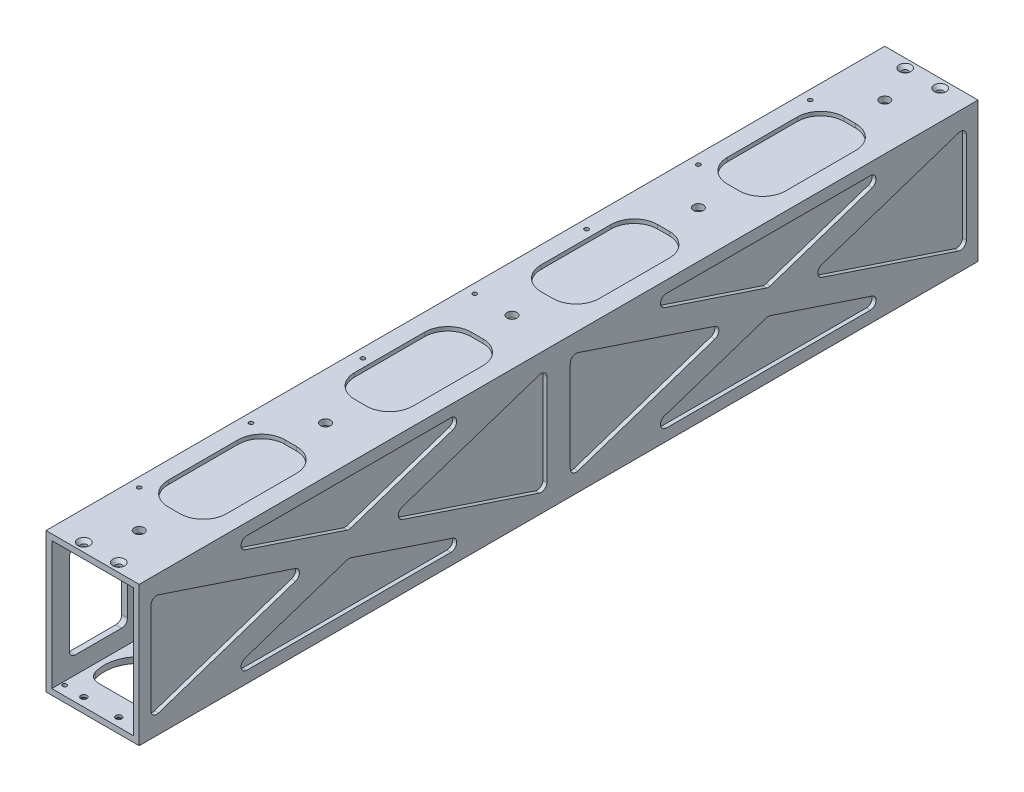
from build123d import *

# Parameters (mm, degrees)
SKETCH1_W                                     = 50.8
SKETCH1_H                                     = 76.2
SKETCH1_W_2                                   = 44.45
SKETCH1_H_2                                   = 69.85
BOSS_EXTRUDE1_DEPTH                           = 457.2
CUT_EXTRUDE2_DEPTH                            = 467.282017667
F_1_4_28_TAPPED_HOLE1_D                       = 5.4102
F_1_4_28_TAPPED_HOLE1_DEPTH                   = 3.175
SKETCH6_W                                     = 53.975
SKETCH6_H                                     = 76.2
BOSS_EXTRUDE2_DEPTH                           = 3.175
CUT_EXTRUDE4_REACH                            = 468.282
SKETCH7_W                                     = 31.75
SKETCH7_H                                     = 50.8
FILLET1_R                                     = 3.175
CUT_EXTRUDE6_REACH                            = 468.282
SKETCH9_R                                     = 19.05
CUT_EXTRUDE7_REACH                            = 468.282
LPATTERN1_COUNT                               = 4
LPATTERN1_PITCH                               = 101.6
CSK_FOR_4_FLAT_HEAD_SOCKET_CAP_SCREW1_A_COUNT = 2
CSK_FOR_4_FLAT_HEAD_SOCKET_CAP_SCREW1_A_PITCH = 19.05
BOSS_EXTRUDE3_START                           = -1.016
BOSS_EXTRUDE3_DEPTH                           = 1.016
BOSS_EXTRUDE4_START                           = -1.016
SKETCH16_R                                    = 19.05
BOSS_EXTRUDE4_DEPTH                           = 1.016
BOSS_EXTRUDE5_START                           = -1.016
BOSS_EXTRUDE5_DEPTH                           = 1.016
F_4_40_TAPPED_HOLE1_D                         = 2.2606
F_4_40_TAPPED_HOLE1_DEPTH                     = 3.175
BOSS_EXTRUDE6_START                           = 2.159
BOSS_EXTRUDE6_DEPTH                           = 2.159
FILLET2_R                                     = 6.35
CUT_EXTRUDE8_REACH                            = 467.934
F_4_40_TAPPED_HOLE2_D                         = 2.2606
F_4_40_TAPPED_HOLE2_DEPTH                     = 3.175


with BuildPart() as part:
    # Sketch1 → Boss-Extrude1 (new body)
    with BuildSketch(Plane.XY):
        with Locations((25.4, 38.1)):
            Rectangle(SKETCH1_W, SKETCH1_H)
        with Locations((25.4, 38.1)):
            Rectangle(SKETCH1_W_2, SKETCH1_H_2, mode=Mode.SUBTRACT)
    extrude(amount=BOSS_EXTRUDE1_DEPTH)

    # Sketch2 → Cut-Extrude2 (cut, through all)
    with BuildSketch(Plane(origin=(50.8, 0, 0), x_dir=(0, 0, -1), z_dir=(1, 0, 0))):
        with BuildLine():
            Line((-222.25, 62.984768429), (-222.25, 13.215231571))
            ThreePointArc((-222.25, 13.215231571), (-220.931455154, 10.639537633), (-218.070976843, 10.2031621))
            Line((-218.070976843, 10.2031621), (-143.416671556, 35.087930529))
            ThreePointArc((-143.416671556, 35.087930529), (-141.245694713, 38.1), (-143.416671556, 41.112069471))
            Line((-143.416671556, 41.112069471), (-218.070976843, 65.9968379))
            ThreePointArc((-218.070976843, 65.9968379), (-220.931455154, 65.560462367), (-222.25, 62.984768429))
        make_face()
        with BuildLine():
            Line((-399.508328444, 63.662930529), (-343.904023157, 45.1281621))
            ThreePointArc((-343.904023157, 45.1281621), (-342.9, 44.965231571), (-341.895976843, 45.1281621))
            Line((-341.895976843, 45.1281621), (-286.291671556, 63.662930529))
            ThreePointArc((-286.291671556, 63.662930529), (-284.161692035, 67.183578622), (-287.295694713, 69.85))
            Line((-287.295694713, 69.85), (-398.504305287, 69.85))
            ThreePointArc((-398.504305287, 69.85), (-401.638307965, 67.183578622), (-399.508328444, 63.662930529))
        make_face()
        with BuildLine():
            Line((-446.670976843, 65.9968379), (-372.016671556, 41.112069471))
            ThreePointArc((-372.016671556, 41.112069471), (-369.845694713, 38.1), (-372.016671556, 35.087930529))
            Line((-372.016671556, 35.087930529), (-446.670976843, 10.2031621))
            ThreePointArc((-446.670976843, 10.2031621), (-449.531455154, 10.639537633), (-450.85, 13.215231571))
            Line((-450.85, 13.215231571), (-450.85, 62.984768429))
            ThreePointArc((-450.85, 62.984768429), (-449.531455154, 65.560462367), (-446.670976843, 65.9968379))
        make_face()
        with BuildLine():
            Line((-234.95, 62.984768429), (-234.95, 13.215231571))
            ThreePointArc((-234.95, 13.215231571), (-236.268544846, 10.639537633), (-239.129023157, 10.2031621))
            Line((-239.129023157, 10.2031621), (-313.783328444, 35.087930529))
            ThreePointArc((-313.783328444, 35.087930529), (-315.954305287, 38.1), (-313.783328444, 41.112069471))
            Line((-313.783328444, 41.112069471), (-239.129023157, 65.9968379))
            ThreePointArc((-239.129023157, 65.9968379), (-236.268544846, 65.560462367), (-234.95, 62.984768429))
        make_face()
        with BuildLine():
            Line((-57.691671556, 63.662930529), (-113.295976843, 45.1281621))
            ThreePointArc((-113.295976843, 45.1281621), (-114.3, 44.965231571), (-115.304023157, 45.1281621))
            Line((-115.304023157, 45.1281621), (-170.908328444, 63.662930529))
            ThreePointArc((-170.908328444, 63.662930529), (-173.038307965, 67.183578622), (-169.904305287, 69.85))
            Line((-169.904305287, 69.85), (-58.695694713, 69.85))
            ThreePointArc((-58.695694713, 69.85), (-55.561692035, 67.183578622), (-57.691671556, 63.662930529))
        make_face()
        with BuildLine():
            Line((-10.529023157, 65.9968379), (-85.183328444, 41.112069471))
            ThreePointArc((-85.183328444, 41.112069471), (-87.354305287, 38.1), (-85.183328444, 35.087930529))
            Line((-85.183328444, 35.087930529), (-10.529023157, 10.2031621))
            ThreePointArc((-10.529023157, 10.2031621), (-7.668544846, 10.639537633), (-6.35, 13.215231571))
            Line((-6.35, 13.215231571), (-6.35, 62.984768429))
            ThreePointArc((-6.35, 62.984768429), (-7.668544846, 65.560462367), (-10.529023157, 65.9968379))
        make_face()
        with BuildLine():
            Line((-398.504305287, 6.35), (-287.295694713, 6.35))
            ThreePointArc((-287.295694713, 6.35), (-284.161692035, 9.016421378), (-286.291671556, 12.537069471))
            Line((-286.291671556, 12.537069471), (-341.895976843, 31.0718379))
            ThreePointArc((-341.895976843, 31.0718379), (-342.9, 31.234768429), (-343.904023157, 31.0718379))
            Line((-343.904023157, 31.0718379), (-399.508328444, 12.537069471))
            ThreePointArc((-399.508328444, 12.537069471), (-401.638307965, 9.016421378), (-398.504305287, 6.35))
        make_face()
        with BuildLine():
            Line((-113.295976843, 31.0718379), (-57.691671556, 12.537069471))
            ThreePointArc((-57.691671556, 12.537069471), (-55.561692035, 9.016421378), (-58.695694713, 6.35))
            Line((-58.695694713, 6.35), (-169.904305287, 6.35))
            ThreePointArc((-169.904305287, 6.35), (-173.038307965, 9.016421378), (-170.908328444, 12.537069471))
            Line((-170.908328444, 12.537069471), (-115.304023157, 31.0718379))
            ThreePointArc((-115.304023157, 31.0718379), (-114.3, 31.234768429), (-113.295976843, 31.0718379))
        make_face()
    extrude(amount=-CUT_EXTRUDE2_DEPTH, mode=Mode.SUBTRACT)

    # 1/4-28 Tapped Hole1
    with Locations(Plane(origin=(0, 76.2, 0), x_dir=(-1, 0, 0), z_dir=(0, 1, 0))):
        with Locations((-25.4, 25.4), (-25.4, 228.6), (-25.4, 431.8), (-25.4, 330.2), (-25.4, 127)):
            Hole(F_1_4_28_TAPPED_HOLE1_D / 2, depth=F_1_4_28_TAPPED_HOLE1_DEPTH)

    # Sketch6 → Boss-Extrude2 (add)
    with BuildSketch(Plane.ZY):
        with Locations((26.9875, 38.1)):
            Rectangle(SKETCH6_W, SKETCH6_H)
    boss_extrude2 = extrude(amount=-BOSS_EXTRUDE2_DEPTH)

    # Sketch7 → Cut-Extrude4 (cut, up to next)
    with BuildSketch(Plane.ZY, mode=Mode.PRIVATE) as cut_extrude4_sk1:
        with Locations((25.4, 38.1)):
            Rectangle(SKETCH7_W, SKETCH7_H)
    cut_extrude4_tool1 = extrude(cut_extrude4_sk1.sketch, amount=-CUT_EXTRUDE4_REACH, mode=Mode.PRIVATE) & part.part
    cut_extrude4 = cut_extrude4_tool1.solids().sort_by_distance((0, 38.1, 25.4))[0]
    add(cut_extrude4, mode=Mode.SUBTRACT)

    # Mirror1: Boss-Extrude2, Cut-Extrude4 across plane
    add(boss_extrude2.mirror(Plane.XY.offset(228.6)))
    add(cut_extrude4.mirror(Plane.XY.offset(228.6)), mode=Mode.SUBTRACT)

    # Fillet1
    fillet1_edges = [part.edges().sort_by_distance(p)[0] for p in [
        (1.5875, 51.514845619, 53.975),
        (1.5875, 24.685154381, 53.975),
        (1.5875, 63.5, 41.275),
        (1.5875, 12.7, 41.275),
        (1.5875, 12.7, 9.525),
        (1.5875, 63.5, 9.525),
        (1.5875, 24.685154381, 403.225),
        (1.5875, 51.514845619, 403.225),
        (1.5875, 12.7, 415.925),
        (1.5875, 63.5, 415.925),
        (1.5875, 63.5, 447.675),
        (1.5875, 12.7, 447.675),
    ]]
    fillet(fillet1_edges, radius=FILLET1_R)

    # Sketch9 → Cut-Extrude6 (cut, up to next)
    with BuildSketch(Plane.XZ, mode=Mode.PRIVATE) as cut_extrude6_sk1:
        with Locations(Location((25.4, 431.8, 0), (0, 0, 270))):
            Circle(SKETCH9_R)
    cut_extrude6_tool1 = extrude(cut_extrude6_sk1.sketch, amount=-CUT_EXTRUDE6_REACH, mode=Mode.PRIVATE) & part.part
    # Sketch9 → Cut-Extrude6 (cut, up to next)
    with BuildSketch(Plane.XZ, mode=Mode.PRIVATE) as cut_extrude6_sk2:
        with Locations(Location((25.4, 381, 0), (0, 0, 270))):
            Circle(SKETCH9_R)
    cut_extrude6_tool2 = extrude(cut_extrude6_sk2.sketch, amount=-CUT_EXTRUDE6_REACH, mode=Mode.PRIVATE) & part.part
    # Sketch9 → Cut-Extrude6 (cut, up to next)
    with BuildSketch(Plane.XZ, mode=Mode.PRIVATE) as cut_extrude6_sk3:
        with Locations(Location((25.4, 330.2, 0), (0, 0, 270))):
            Circle(SKETCH9_R)
    cut_extrude6_tool3 = extrude(cut_extrude6_sk3.sketch, amount=-CUT_EXTRUDE6_REACH, mode=Mode.PRIVATE) & part.part
    # Sketch9 → Cut-Extrude6 (cut, up to next)
    with BuildSketch(Plane.XZ, mode=Mode.PRIVATE) as cut_extrude6_sk4:
        with Locations(Location((25.4, 279.4, 0), (0, 0, 270))):
            Circle(SKETCH9_R)
    cut_extrude6_tool4 = extrude(cut_extrude6_sk4.sketch, amount=-CUT_EXTRUDE6_REACH, mode=Mode.PRIVATE) & part.part
    # Sketch9 → Cut-Extrude6 (cut, up to next)
    with BuildSketch(Plane.XZ, mode=Mode.PRIVATE) as cut_extrude6_sk5:
        with Locations(Location((25.4, 228.6, 0), (0, 0, 270))):
            Circle(SKETCH9_R)
    cut_extrude6_tool5 = extrude(cut_extrude6_sk5.sketch, amount=-CUT_EXTRUDE6_REACH, mode=Mode.PRIVATE) & part.part
    # Sketch9 → Cut-Extrude6 (cut, up to next)
    with BuildSketch(Plane.XZ, mode=Mode.PRIVATE) as cut_extrude6_sk6:
        with Locations(Location((25.4, 177.8, 0), (0, 0, 270))):
            Circle(SKETCH9_R)
    cut_extrude6_tool6 = extrude(cut_extrude6_sk6.sketch, amount=-CUT_EXTRUDE6_REACH, mode=Mode.PRIVATE) & part.part
    # Sketch9 → Cut-Extrude6 (cut, up to next)
    with BuildSketch(Plane.XZ, mode=Mode.PRIVATE) as cut_extrude6_sk7:
        with Locations(Location((25.4, 127, 0), (0, 0, 270))):
            Circle(SKETCH9_R)
    cut_extrude6_tool7 = extrude(cut_extrude6_sk7.sketch, amount=-CUT_EXTRUDE6_REACH, mode=Mode.PRIVATE) & part.part
    # Sketch9 → Cut-Extrude6 (cut, up to next)
    with BuildSketch(Plane.XZ, mode=Mode.PRIVATE) as cut_extrude6_sk8:
        with Locations(Location((25.4, 76.2, 0), (0, 0, 270))):
            Circle(SKETCH9_R)
    cut_extrude6_tool8 = extrude(cut_extrude6_sk8.sketch, amount=-CUT_EXTRUDE6_REACH, mode=Mode.PRIVATE) & part.part
    # Sketch9 → Cut-Extrude6 (cut, up to next)
    with BuildSketch(Plane.XZ, mode=Mode.PRIVATE) as cut_extrude6_sk9:
        with Locations(Location((25.4, 25.4, 0), (0, 0, 270))):
            Circle(SKETCH9_R)
    cut_extrude6_tool9 = extrude(cut_extrude6_sk9.sketch, amount=-CUT_EXTRUDE6_REACH, mode=Mode.PRIVATE) & part.part
    add(cut_extrude6_tool1.solids().sort_by_distance((25.4, 0, 431.8))[0], mode=Mode.SUBTRACT)
    add(cut_extrude6_tool2.solids().sort_by_distance((25.4, 0, 381))[0], mode=Mode.SUBTRACT)
    add(cut_extrude6_tool3.solids().sort_by_distance((25.4, 0, 330.2))[0], mode=Mode.SUBTRACT)
    add(cut_extrude6_tool4.solids().sort_by_distance((25.4, 0, 279.4))[0], mode=Mode.SUBTRACT)
    add(cut_extrude6_tool5.solids().sort_by_distance((25.4, 0, 228.6))[0], mode=Mode.SUBTRACT)
    add(cut_extrude6_tool6.solids().sort_by_distance((25.4, 0, 177.8))[0], mode=Mode.SUBTRACT)
    add(cut_extrude6_tool7.solids().sort_by_distance((25.4, 0, 127))[0], mode=Mode.SUBTRACT)
    add(cut_extrude6_tool8.solids().sort_by_distance((25.4, 0, 76.2))[0], mode=Mode.SUBTRACT)
    add(cut_extrude6_tool9.solids().sort_by_distance((25.4, 0, 25.4))[0], mode=Mode.SUBTRACT)

    # Sketch10 → Cut-Extrude7 (cut, up to next)
    with BuildSketch(Plane(origin=(0, 76.2, 0), x_dir=(1, 0, 0), z_dir=(0, 1, 0)), mode=Mode.PRIVATE) as cut_extrude7_sk1:
        with BuildLine():
            Line((28.575, -107.95), (22.225, -107.95))
            ThreePointArc((22.225, -107.95), (13.244743879, -104.230256121), (9.525, -95.25))
            Line((9.525, -95.25), (9.525, -57.15))
            ThreePointArc((9.525, -57.15), (13.244743879, -48.169743879), (22.225, -44.45))
            Line((22.225, -44.45), (28.575, -44.45))
            ThreePointArc((28.575, -44.45), (37.555256121, -48.169743879), (41.275, -57.15))
            Line((41.275, -57.15), (41.275, -95.25))
            ThreePointArc((41.275, -95.25), (37.555256121, -104.230256121), (28.575, -107.95))
        make_face()
    cut_extrude7_tool1 = extrude(cut_extrude7_sk1.sketch, amount=-CUT_EXTRUDE7_REACH, mode=Mode.PRIVATE) & part.part
    cut_extrude7 = cut_extrude7_tool1.solids().sort_by_distance((25.4, 76.2, 76.2))[0]
    add(cut_extrude7, mode=Mode.SUBTRACT)

    # LPattern1: Cut-Extrude7 ×4
    with Locations(*[(0, 0, i * LPATTERN1_PITCH) for i in range(1, LPATTERN1_COUNT)]):
        add(cut_extrude7, mode=Mode.SUBTRACT)

    # Sketch12 → CSK for #4 Flat Head Socket Cap Screw1 (revolve, cut)
    with BuildSketch(Plane(origin=(15.875, 76.2, 4.7625), x_dir=(0, 0, 1), z_dir=(1, 0, 0))):
        Polygon((0, 0), (0, 3.176), (1.63195, 3.176), (1.63195, 1.848124365), (3.2385, 0), align=None)
    csk_for_4_flat_head_socket_cap_screw1 = revolve(axis=Axis((15.875, 82.55, 4.7625), (0, -1, 0)), mode=Mode.SUBTRACT)

    # CSK for #4 Flat Head Socket Cap Screw1 a: CSK for #4 Flat Head Socket Cap Screw1 ×2
    with Locations(*[(i * CSK_FOR_4_FLAT_HEAD_SOCKET_CAP_SCREW1_A_PITCH, 0, 0) for i in range(1, CSK_FOR_4_FLAT_HEAD_SOCKET_CAP_SCREW1_A_COUNT)]):
        add(csk_for_4_flat_head_socket_cap_screw1, mode=Mode.SUBTRACT)

    # Mirror2: CSK for #4 Flat Head Socket Cap Screw1 across plane
    add(csk_for_4_flat_head_socket_cap_screw1.mirror(Plane.ZX.offset(38.1)), mode=Mode.SUBTRACT)

    # Mirror2 copy 1 sketch → Mirror2 copy 1 (revolve, cut)
    with BuildSketch(Plane(origin=(34.925, 0, 4.7625), x_dir=(0, 0, 1), z_dir=(1, 0, 0))):
        Polygon((0, 0), (0, -3.176), (1.63195, -3.176), (1.63195, -1.848124365), (3.2385, 0), align=None)
    revolve(axis=Axis((34.925, -6.35, 4.7625), (0, -1, 0)), mode=Mode.SUBTRACT)

    # Mirror3: CSK for #4 Flat Head Socket Cap Screw1 across plane
    add(csk_for_4_flat_head_socket_cap_screw1.mirror(Plane(origin=(0, 0, 228.6), x_dir=(1, 0, 0), z_dir=(0, 0, -1))), mode=Mode.SUBTRACT)

    # Mirror3 copy 1 sketch → Mirror3 copy 1 (revolve, cut)
    with BuildSketch(Plane(origin=(34.925, 76.2, 452.4375), x_dir=(0, 0, -1), z_dir=(1, 0, 0))):
        Polygon((0, 0), (0, -3.176), (1.63195, -3.176), (1.63195, -1.848124365), (3.2385, 0), align=None)
    revolve(axis=Axis((34.925, 82.55, 452.4375), (0, 1, 0)), mode=Mode.SUBTRACT)

    # Mirror3 copy 2 sketch → Mirror3 copy 2 (revolve, cut)
    with BuildSketch(Plane(origin=(15.875, 0, 452.4375), x_dir=(0, 0, -1), z_dir=(1, 0, 0))):
        Polygon((0, 0), (0, 3.176), (1.63195, 3.176), (1.63195, 1.848124365), (3.2385, 0), align=None)
    revolve(axis=Axis((15.875, -6.35, 452.4375), (0, 1, 0)), mode=Mode.SUBTRACT)

    # Mirror3 copy 3 sketch → Mirror3 copy 3 (revolve, cut)
    with BuildSketch(Plane(origin=(34.925, 0, 452.4375), x_dir=(0, 0, -1), z_dir=(1, 0, 0))):
        Polygon((0, 0), (0, 3.176), (1.63195, 3.176), (1.63195, 1.848124365), (3.2385, 0), align=None)
    revolve(axis=Axis((34.925, -6.35, 452.4375), (0, 1, 0)), mode=Mode.SUBTRACT)

    # Sketch15 → Boss-Extrude3 (add)
    with BuildSketch(Plane.ZY.offset(-47.625).offset(BOSS_EXTRUDE3_START)):
        with BuildLine():
            Line((446.670976843, 65.9968379), (372.016671556, 41.112069471))
            ThreePointArc((372.016671556, 41.112069471), (369.845694713, 38.1), (372.016671556, 35.087930529))
            Line((372.016671556, 35.087930529), (446.670976843, 10.2031621))
            ThreePointArc((446.670976843, 10.2031621), (449.531455154, 10.639537633), (450.85, 13.215231571))
            Line((450.85, 13.215231571), (450.85, 62.984768429))
            ThreePointArc((450.85, 62.984768429), (449.531455154, 65.560462367), (446.670976843, 65.9968379))
        make_face()
        with BuildLine():
            Line((398.504305287, 69.85), (287.295694713, 69.85))
            ThreePointArc((287.295694713, 69.85), (284.161692035, 67.183578622), (286.291671556, 63.662930529))
            Line((286.291671556, 63.662930529), (341.895976843, 45.1281621))
            ThreePointArc((341.895976843, 45.1281621), (342.9, 44.965231571), (343.904023157, 45.1281621))
            Line((343.904023157, 45.1281621), (399.508328444, 63.662930529))
            ThreePointArc((399.508328444, 63.662930529), (401.638307965, 67.183578622), (398.504305287, 69.85))
        make_face()
        with BuildLine():
            Line((341.895976843, 31.0718379), (286.291671556, 12.537069471))
            ThreePointArc((286.291671556, 12.537069471), (284.161692035, 9.016421378), (287.295694713, 6.35))
            Line((287.295694713, 6.35), (398.504305287, 6.35))
            ThreePointArc((398.504305287, 6.35), (401.638307965, 9.016421378), (399.508328444, 12.537069471))
            Line((399.508328444, 12.537069471), (343.904023157, 31.0718379))
            ThreePointArc((343.904023157, 31.0718379), (342.9, 31.234768429), (341.895976843, 31.0718379))
        make_face()
        with BuildLine():
            Line((239.129023157, 10.2031621), (313.783328444, 35.087930529))
            ThreePointArc((313.783328444, 35.087930529), (315.954305287, 38.1), (313.783328444, 41.112069471))
            Line((313.783328444, 41.112069471), (239.129023157, 65.9968379))
            ThreePointArc((239.129023157, 65.9968379), (236.268544846, 65.560462367), (234.95, 62.984768429))
            Line((234.95, 62.984768429), (234.95, 13.215231571))
            ThreePointArc((234.95, 13.215231571), (236.268544846, 10.639537633), (239.129023157, 10.2031621))
        make_face()
        with BuildLine():
            Line((143.416671556, 35.087930529), (218.070976843, 10.2031621))
            ThreePointArc((218.070976843, 10.2031621), (220.931455154, 10.639537633), (222.25, 13.215231571))
            Line((222.25, 13.215231571), (222.25, 62.984768429))
            ThreePointArc((222.25, 62.984768429), (220.931455154, 65.560462367), (218.070976843, 65.9968379))
            Line((218.070976843, 65.9968379), (143.416671556, 41.112069471))
            ThreePointArc((143.416671556, 41.112069471), (141.245694713, 38.1), (143.416671556, 35.087930529))
        make_face()
        with BuildLine():
            Line((57.691671556, 63.662930529), (113.295976843, 45.1281621))
            ThreePointArc((113.295976843, 45.1281621), (114.3, 44.965231571), (115.304023157, 45.1281621))
            Line((115.304023157, 45.1281621), (170.908328444, 63.662930529))
            ThreePointArc((170.908328444, 63.662930529), (173.038307965, 67.183578622), (169.904305287, 69.85))
            Line((169.904305287, 69.85), (58.695694713, 69.85))
            ThreePointArc((58.695694713, 69.85), (55.561692035, 67.183578622), (57.691671556, 63.662930529))
        make_face()
        with BuildLine():
            Line((113.295976843, 31.0718379), (57.691671556, 12.537069471))
            ThreePointArc((57.691671556, 12.537069471), (55.561692035, 9.016421378), (58.695694713, 6.35))
            Line((58.695694713, 6.35), (169.904305287, 6.35))
            ThreePointArc((169.904305287, 6.35), (173.038307965, 9.016421378), (170.908328444, 12.537069471))
            Line((170.908328444, 12.537069471), (115.304023157, 31.0718379))
            ThreePointArc((115.304023157, 31.0718379), (114.3, 31.234768429), (113.295976843, 31.0718379))
        make_face()
        with BuildLine():
            Line((10.529023157, 10.2031621), (85.183328444, 35.087930529))
            ThreePointArc((85.183328444, 35.087930529), (87.354305287, 38.1), (85.183328444, 41.112069471))
            Line((85.183328444, 41.112069471), (10.529023157, 65.9968379))
            ThreePointArc((10.529023157, 65.9968379), (7.668544846, 65.560462367), (6.35, 62.984768429))
            Line((6.35, 62.984768429), (6.35, 13.215231571))
            ThreePointArc((6.35, 13.215231571), (7.668544846, 10.639537633), (10.529023157, 10.2031621))
        make_face()
    extrude(amount=BOSS_EXTRUDE3_DEPTH)

    # Sketch16 → Boss-Extrude4 (add)
    with BuildSketch(Plane(origin=(0, 3.175, 0), x_dir=(1, 0, 0), z_dir=(0, 1, 0)).offset(BOSS_EXTRUDE4_START)):
        with Locations(Location((25.4, -431.8, 0), (0, 0, 90))):
            Circle(SKETCH16_R)
        with Locations(Location((25.4, -25.4, 0), (0, 0, 90))):
            Circle(SKETCH16_R)
    extrude(amount=BOSS_EXTRUDE4_DEPTH)

    # Sketch17 → Boss-Extrude5 (add)
    with BuildSketch(Plane.XZ.offset(-73.025).offset(BOSS_EXTRUDE5_START)):
        with BuildLine():
            Line((41.275, 57.15), (41.275, 95.25))
            ThreePointArc((41.275, 95.25), (37.555256121, 104.230256121), (28.575, 107.95))
            Line((28.575, 107.95), (22.225, 107.95))
            ThreePointArc((22.225, 107.95), (13.244743879, 104.230256121), (9.525, 95.25))
            Line((9.525, 95.25), (9.525, 57.15))
            ThreePointArc((9.525, 57.15), (13.244743879, 48.169743879), (22.225, 44.45))
            Line((22.225, 44.45), (28.575, 44.45))
            ThreePointArc((28.575, 44.45), (37.555256121, 48.169743879), (41.275, 57.15))
        make_face()
        with BuildLine():
            Line((41.275, 158.75), (41.275, 196.85))
            ThreePointArc((41.275, 196.85), (37.555256121, 205.830256121), (28.575, 209.55))
            Line((28.575, 209.55), (22.225, 209.55))
            ThreePointArc((22.225, 209.55), (13.244743879, 205.830256121), (9.525, 196.85))
            Line((9.525, 196.85), (9.525, 158.75))
            ThreePointArc((9.525, 158.75), (13.244743879, 149.769743879), (22.225, 146.05))
            Line((22.225, 146.05), (28.575, 146.05))
            ThreePointArc((28.575, 146.05), (37.555256121, 149.769743879), (41.275, 158.75))
        make_face()
        with BuildLine():
            Line((41.275, 260.35), (41.275, 298.45))
            ThreePointArc((41.275, 298.45), (37.555256121, 307.430256121), (28.575, 311.15))
            Line((28.575, 311.15), (22.225, 311.15))
            ThreePointArc((22.225, 311.15), (13.244743879, 307.430256121), (9.525, 298.45))
            Line((9.525, 298.45), (9.525, 260.35))
            ThreePointArc((9.525, 260.35), (13.244743879, 251.369743879), (22.225, 247.65))
            Line((22.225, 247.65), (28.575, 247.65))
            ThreePointArc((28.575, 247.65), (37.555256121, 251.369743879), (41.275, 260.35))
        make_face()
        with BuildLine():
            Line((41.275, 361.95), (41.275, 400.05))
            ThreePointArc((41.275, 400.05), (37.555256121, 409.030256121), (28.575, 412.75))
            Line((28.575, 412.75), (22.225, 412.75))
            ThreePointArc((22.225, 412.75), (13.244743879, 409.030256121), (9.525, 400.05))
            Line((9.525, 400.05), (9.525, 361.95))
            ThreePointArc((9.525, 361.95), (13.244743879, 352.969743879), (22.225, 349.25))
            Line((22.225, 349.25), (28.575, 349.25))
            ThreePointArc((28.575, 349.25), (37.555256121, 352.969743879), (41.275, 361.95))
        make_face()
    extrude(amount=BOSS_EXTRUDE5_DEPTH)

    # #4-40 Tapped Hole1
    with Locations(Plane.XZ):
        with Locations((45.72, 444.5), (5.08, 452.12), (45.72, 406.4), (45.72, 355.6), (45.72, 304.8), (45.72, 254), (45.72, 203.2), (45.72, 152.4), (45.72, 101.6), (45.72, 50.8), (45.72, 12.7), (5.08, 5.08)):
            Hole(F_4_40_TAPPED_HOLE1_D / 2, depth=F_4_40_TAPPED_HOLE1_DEPTH)

    # Sketch21 → Boss-Extrude6 (add)
    with BuildSketch(Plane.XZ.offset(-2.159).offset(BOSS_EXTRUDE6_START)):
        with BuildLine():
            Line((9.285506524, 441.96), (41.514493476, 441.96))
            ThreePointArc((41.514493476, 441.96), (25.4, 450.85), (9.285506524, 441.96))
        make_face()
        with BuildLine():
            Line((9.285506524, 15.24), (41.514493476, 15.24))
            ThreePointArc((41.514493476, 15.24), (25.4, 6.35), (9.285506524, 15.24))
        make_face()
    extrude(amount=-BOSS_EXTRUDE6_DEPTH)

    # Fillet2
    fillet2_edges = [part.edges().sort_by_distance(p)[0] for p in [
        (9.285506524, 1.0795, 441.96),
        (41.514493476, 1.0795, 441.96),
        (41.514493476, 1.0795, 15.24),
        (9.285506524, 1.0795, 15.24),
    ]]
    fillet(fillet2_edges, radius=FILLET2_R)

    # Sketch22 → Cut-Extrude8 (cut, up to next)
    with BuildSketch(Plane.XZ.offset(-2.159), mode=Mode.PRIVATE) as cut_extrude8_sk1:
        with BuildLine():
            Line((13.284972142, 15.24), (37.515027858, 15.24))
            ThreePointArc((37.515027858, 15.24), (41.27173852, 16.47046633), (43.572541787, 19.685))
            ThreePointArc((43.572541787, 19.685), (25.4, 44.45), (7.227458213, 19.685))
            ThreePointArc((7.227458213, 19.685), (9.52826148, 16.47046633), (13.284972142, 15.24))
        make_face()
    cut_extrude8_tool1 = extrude(cut_extrude8_sk1.sketch, amount=-CUT_EXTRUDE8_REACH, mode=Mode.PRIVATE) & part.part
    # Sketch22 → Cut-Extrude8 (cut, up to next)
    with BuildSketch(Plane.XZ.offset(-2.159), mode=Mode.PRIVATE) as cut_extrude8_sk2:
        with BuildLine():
            Line((37.515027858, 441.96), (13.284972142, 441.96))
            ThreePointArc((13.284972142, 441.96), (9.52826148, 440.72953367), (7.227458213, 437.515))
            ThreePointArc((7.227458213, 437.515), (25.4, 412.75), (43.572541787, 437.515))
            ThreePointArc((43.572541787, 437.515), (41.27173852, 440.72953367), (37.515027858, 441.96))
        make_face()
    cut_extrude8_tool2 = extrude(cut_extrude8_sk2.sketch, amount=-CUT_EXTRUDE8_REACH, mode=Mode.PRIVATE) & part.part
    add(cut_extrude8_tool1.solids().sort_by_distance((25.4, 2.159, 28.456021))[0], mode=Mode.SUBTRACT)
    add(cut_extrude8_tool2.solids().sort_by_distance((25.4, 2.159, 428.743979))[0], mode=Mode.SUBTRACT)

    # #4-40 Tapped Hole2
    with Locations(Plane(origin=(0, 76.2, 0), x_dir=(-1, 0, 0), z_dir=(0, 1, 0))):
        with Locations((-5.08, 45.72), (-5.08, 106.68), (-5.08, 167.64), (-5.08, 228.6), (-5.08, 289.56), (-5.08, 350.52), (-5.08, 411.48)):
            Hole(F_4_40_TAPPED_HOLE2_D / 2, depth=F_4_40_TAPPED_HOLE2_DEPTH)


solid = part.part
